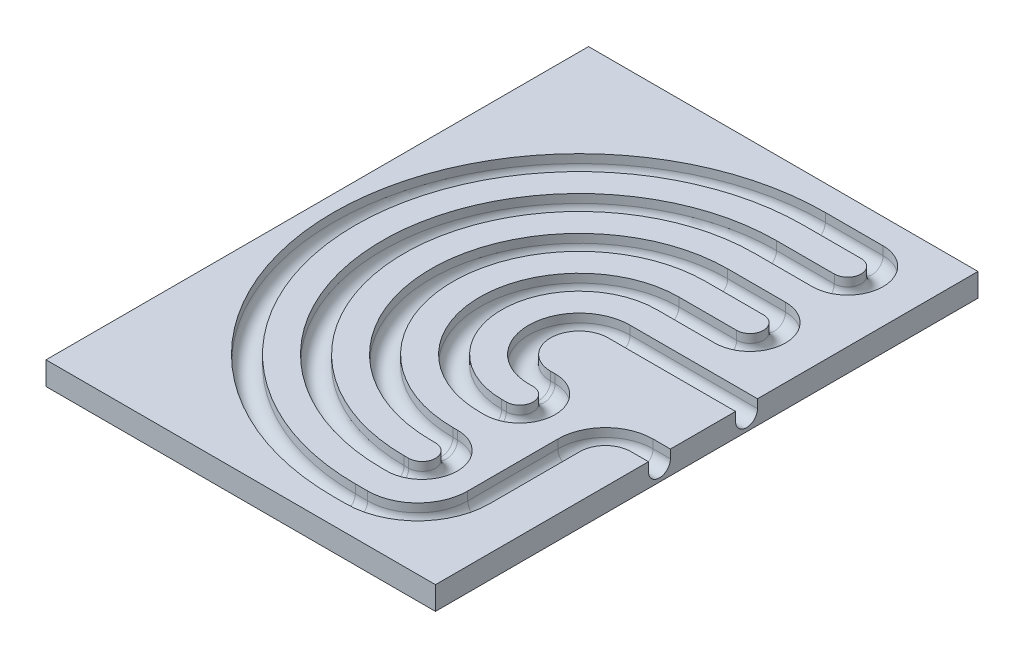
from build123d import *

# Parameters (mm, degrees)
SKETCH1_W           = 159.601
SKETCH1_H           = 222.325
BOSS_EXTRUDE1_DEPTH = 9.5


with BuildPart() as part:
    # Sketch1 → Boss-Extrude1 (new body)
    with BuildSketch(Plane(origin=(0, 0, 0), x_dir=(1, 0, 0), z_dir=(0, 1, 0))):
        Rectangle(SKETCH1_W, SKETCH1_H)
    extrude(amount=BOSS_EXTRUDE1_DEPTH)

    # Cut-Sweep1: sweep along a path in Sketch3
    with BuildLine(Plane(origin=(0, 9.5, 0), x_dir=(1, 0, 0), z_dir=(0, 1, 0))) as cut_sweep1_path:
        Line((79.8005, 16.305743326), (27.599475384, 16.305743326))
        ThreePointArc((27.599475384, 16.305743326), (11.293732058, 0), (27.599475384, -16.305743326))
        Line((27.599475384, -16.305743326), (29.470626257, -16.305743326))
        ThreePointArc((29.470626257, -16.305743326), (39.470626257, -26.305743326), (29.470626257, -36.305743326))
        Line((29.470626257, -36.305743326), (27.599475384, -36.305743326))
        ThreePointArc((27.599475384, -36.305743326), (-8.706267942, 0), (27.599475384, 36.305743326))
        Line((27.599475384, 36.305743326), (51.25616857, 36.305743326))
        ThreePointArc((51.25616857, 36.305743326), (61.25616857, 46.305743326), (51.25616857, 56.305743326))
        Line((51.25616857, 56.305743326), (27.599475384, 56.305743326))
        ThreePointArc((27.599475384, 56.305743326), (-28.706267942, 0), (27.599475384, -56.305743326))
        Line((27.599475384, -56.305743326), (29.470626257, -56.305743326))
        ThreePointArc((29.470626257, -56.305743326), (39.470626257, -66.305743326), (29.470626257, -76.305743326))
        Line((29.470626257, -76.305743326), (27.599475384, -76.305743326))
        ThreePointArc((27.599475384, -76.305743326), (-48.706267942, 0), (27.599475384, 76.305743326))
        Line((27.599475384, 76.305743326), (51.25616857, 76.305743326))
        ThreePointArc((51.25616857, 76.305743326), (61.25616857, 86.305743326), (51.25616857, 96.305743326))
        Line((51.25616857, 96.305743326), (27.599475384, 96.305743326))
        ThreePointArc((27.599475384, 96.305743326), (-68.706267942, 0), (27.599475384, -96.305743326))
        Line((27.599475384, -96.305743326), (32.671542994, -96.305743326))
        ThreePointArc((32.671542994, -96.305743326), (50.349212523, -88.983412856), (57.671542994, -71.305743326))
        Line((57.671542994, -71.305743326), (57.671542994, -34.379776904))
        ThreePointArc((57.671542994, -34.379776904), (62.064941276, -23.773175186), (72.671542994, -19.379776904))
        Line((72.671542994, -19.379776904), (79.8005, -19.379776904))
    # Sketch4 → Cut-Sweep1 (sweep, cut)
    with BuildSketch(Plane(origin=(79.8005, 0, 0), x_dir=(0, 0, -1), z_dir=(1, 0, 0))):
        with BuildLine():
            Line((11.805743326, 9.5), (20.805743326, 9.5))
            Line((20.805743326, 9.5), (20.805743326, 6))
            ThreePointArc((20.805743326, 6), (16.305743326, 1.5), (11.805743326, 6))
            Line((11.805743326, 6), (11.805743326, 9.5))
        make_face()
    sweep(path=cut_sweep1_path.line, mode=Mode.SUBTRACT)


solid = part.part
